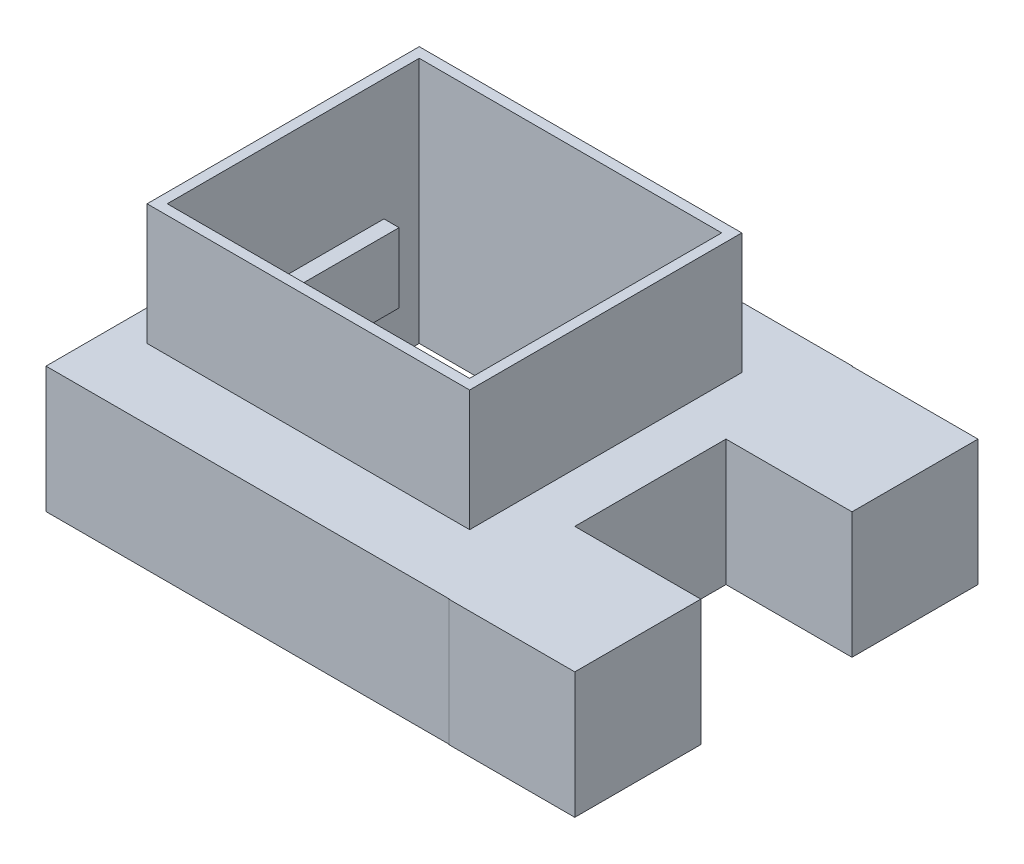
from build123d import *

# Parameters (mm, degrees)
SKETCH3_W           = 4000
SKETCH3_H           = 4000
BOSS_EXTRUDE1_DEPTH = 1250
SKETCH4_W           = 3200
SKETCH4_H           = 2700
BOSS_EXTRUDE2_DEPTH = 1200
SKETCH6_W           = 3000
SKETCH6_H           = 2500
CUT_EXTRUDE1_DEPTH  = 6011.745093863
SKETCH9_W           = 2000
SKETCH9_H           = 690
BOSS_EXTRUDE8_DEPTH = 150
SKETCH8_W           = 2000
SKETCH8_H           = 690
BOSS_EXTRUDE9_DEPTH = 150
SKETCH13_W          = 1250
SKETCH13_H          = 1250
BOSS_EXTRUDE5_DEPTH = 1250
SKETCH14_W          = 1250
SKETCH14_H          = 1250
BOSS_EXTRUDE6_DEPTH = 1250
SCALE1_SCALE        = 0.01


with BuildPart() as part:
    # Sketch3 → Boss-Extrude1 (new body)
    with BuildSketch(Plane(origin=(0, 0, 0), x_dir=(1, 0, 0), z_dir=(0, 1, 0))):
        with Locations((-1806.81348539, 1954.077347606)):
            Rectangle(SKETCH3_W, SKETCH3_H)
    extrude(amount=BOSS_EXTRUDE1_DEPTH)

    # Sketch4 → Boss-Extrude2 (add)
    with BuildSketch(Plane(origin=(0, 1250, 0), x_dir=(1, 0, 0), z_dir=(0, 1, 0))):
        with Locations((-1900, 2000)):
            Rectangle(SKETCH4_W, SKETCH4_H)
    extrude(amount=BOSS_EXTRUDE2_DEPTH)

    # Sketch6 → Cut-Extrude1 (cut, through all)
    with BuildSketch(Plane(origin=(0, 2450, 0), x_dir=(1, 0, 0), z_dir=(0, 1, 0))):
        with Locations((-1900, 2000)):
            Rectangle(SKETCH6_W, SKETCH6_H)
    extrude(amount=-CUT_EXTRUDE1_DEPTH, mode=Mode.SUBTRACT)

    # Sketch9 → Boss-Extrude8 (add)
    with BuildSketch(Plane.ZY.offset(400)):
        with Locations((-1900, 900)):
            Rectangle(SKETCH9_W, SKETCH9_H)
    extrude(amount=BOSS_EXTRUDE8_DEPTH)

    # Sketch8 → Boss-Extrude9 (add)
    with BuildSketch(Plane(origin=(-3400, 0, 0), x_dir=(0, 0, -1), z_dir=(1, 0, 0))):
        with Locations((1900, 900)):
            Rectangle(SKETCH8_W, SKETCH8_H)
    extrude(amount=BOSS_EXTRUDE9_DEPTH)

    # Sketch13 → Boss-Extrude5 (add)
    with BuildSketch(Plane(origin=(193.18651461, 0, 0), x_dir=(0, 0, -1), z_dir=(1, 0, 0))):
        with Locations((575, 625)):
            Rectangle(SKETCH13_W, SKETCH13_H)
    extrude(amount=BOSS_EXTRUDE5_DEPTH)

    # Sketch14 → Boss-Extrude6 (add)
    with BuildSketch(Plane(origin=(193.18651461, 0, 0), x_dir=(0, 0, -1), z_dir=(1, 0, 0))):
        with Locations((3325, 625)):
            Rectangle(SKETCH14_W, SKETCH14_H)
    extrude(amount=BOSS_EXTRUDE6_DEPTH)


with BuildPart() as part_1:
    # Scale1: scaled about (-1134.876780231, 734.705300906, -1929.188509471)
    add(part.part.scale(SCALE1_SCALE).moved(Location((-1123.528012429, 727.358247897, -1909.896624376))))


solid = part_1.part
